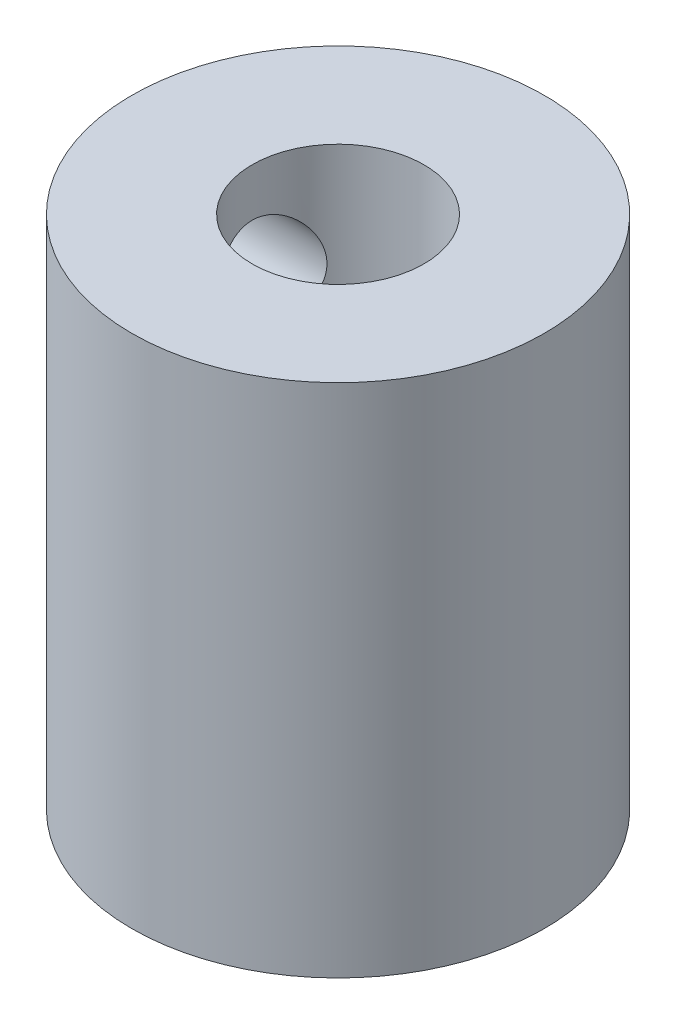
from build123d import *

# Parameters (mm, degrees)
SKETCH1_R           = 7.62
SKETCH1_R_2         = 3.175
BOSS_EXTRUDE1_DEPTH = 19.05
SKETCH2_R           = 2.032
CUT_EXTRUDE1_DEPTH  = 22.886783683


with BuildPart() as part:
    # Sketch1 → Boss-Extrude1 (new body)
    with BuildSketch(Plane(origin=(0, 0, 0), x_dir=(1, 0, 0), z_dir=(0, 1, 0))):
        with Locations(Location((0, 0, 0), (0, 0, 90))):
            Circle(SKETCH1_R)
        with Locations(Location((0, 0, 0), (0, 0, 90))):
            Circle(SKETCH1_R_2, mode=Mode.SUBTRACT)
    extrude(amount=BOSS_EXTRUDE1_DEPTH)

    # Sketch2 → Cut-Extrude1 (cut, through all)
    with BuildSketch(Plane(origin=(0, 0, 0), x_dir=(0, 0, -1), z_dir=(1, 0, 0))):
        with Locations((0, 3.81)):
            Circle(SKETCH2_R)
        with Locations((0, 15.24)):
            Circle(SKETCH2_R)
    extrude(amount=-CUT_EXTRUDE1_DEPTH, mode=Mode.SUBTRACT)


solid = part.part
